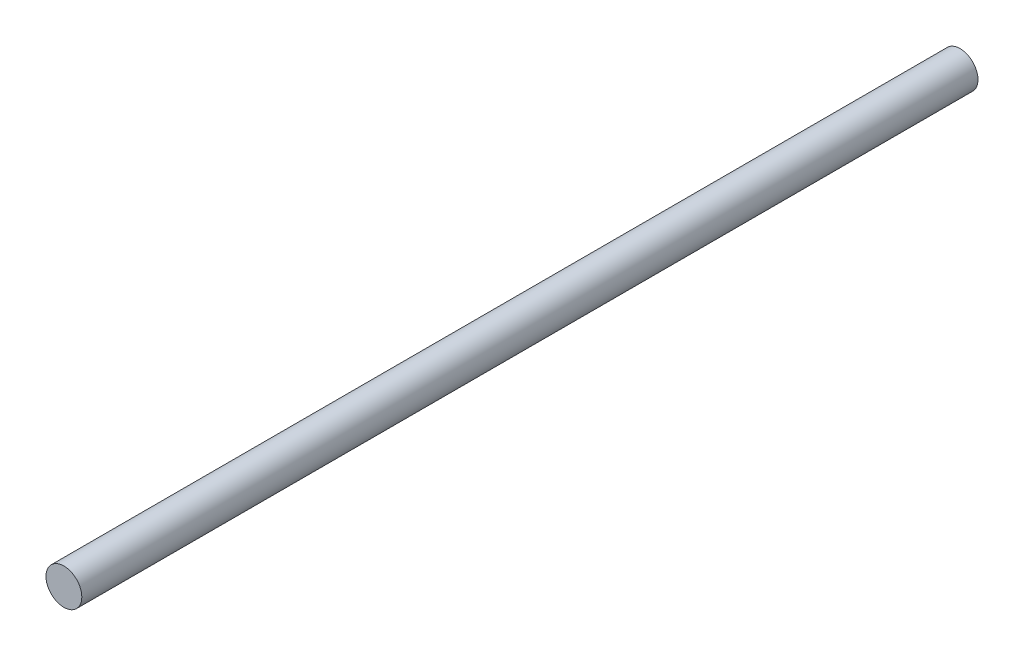
from build123d import *

# Parameters (mm, degrees)
SKETCH1_R           = 3
BOSS_EXTRUDE1_DEPTH = 150


with BuildPart() as part:
    # Sketch1 → Boss-Extrude1 (new body)
    with BuildSketch(Plane.XY):
        with Locations((125.534791728, 68.065682513)):
            Circle(SKETCH1_R)
    extrude(amount=BOSS_EXTRUDE1_DEPTH)


solid = part.part
